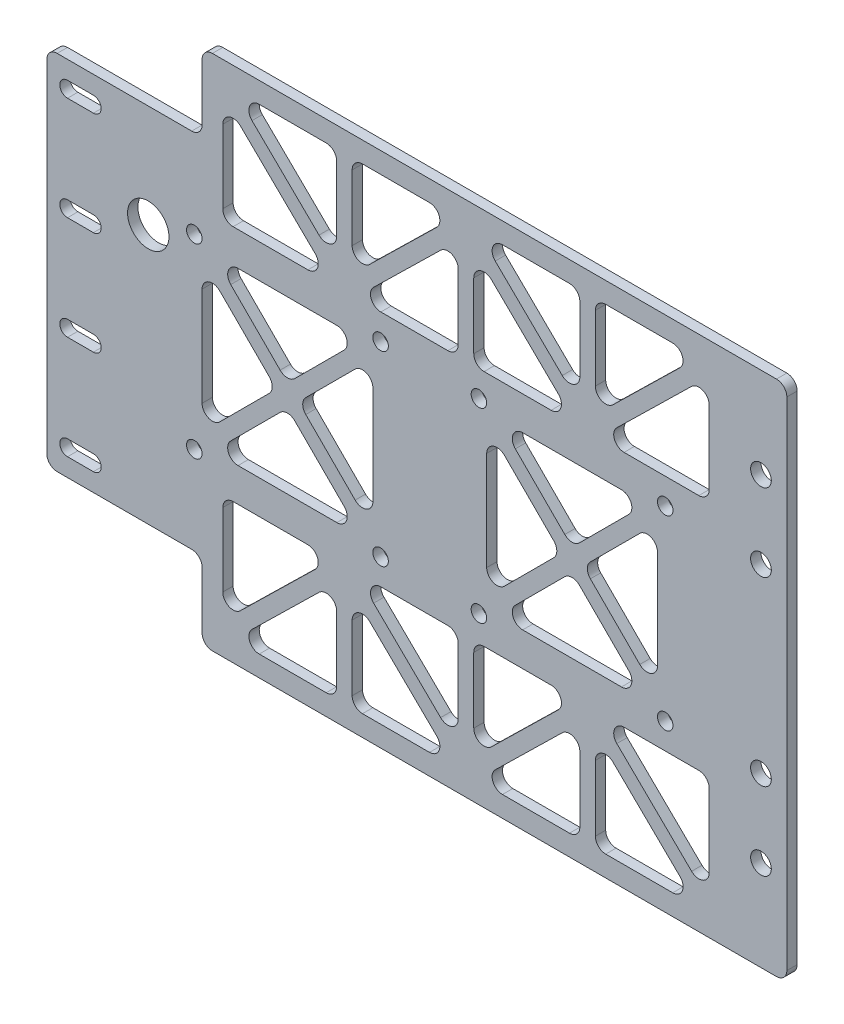
from build123d import *

# Parameters (mm, degrees)
SKETCH_1_W          = 143
SKETCH_1_H          = 100
EXTRUDE_1_DEPTH     = 2
SKETCH_2_R          = 2
CUT_EXTRUDE_1_DEPTH = 2
SKETCH_3_R          = 1.5
CUT_EXTRUDE_2_DEPTH = 2
SKETCH_4_W          = 30
SKETCH_4_H          = 15
CUT_EXTRUDE_3_DEPTH = 2
CUT_EXTRUDE_4_DEPTH = 2
SKETCH_6_R          = 4
CUT_EXTRUDE_5_DEPTH = 10
FILLET_1_R          = 2


with BuildPart() as part:
    # 草图1 → 凸台-拉伸1 (new body)
    with BuildSketch(Plane.XY):
        Rectangle(SKETCH_1_W, SKETCH_1_H)
    extrude(amount=EXTRUDE_1_DEPTH)

    # 草图2 → 切除-拉伸1 (cut)
    with BuildSketch(Plane.XY.offset(2)):
        with Locations((66.5, 32.5)):
            Circle(SKETCH_2_R)
        with Locations((66.5, 17.5)):
            Circle(SKETCH_2_R)
        with Locations(Location((66.5, -17.5, 0), (0, 0, 180))):
            Circle(SKETCH_2_R)
        with Locations(Location((66.5, -32.5, 0), (0, 0, 180))):
            Circle(SKETCH_2_R)
        with BuildLine():
            Line((-67.5, 11.5), (-62.5, 11.5))
            ThreePointArc((-62.5, 11.5), (-61, 10), (-62.5, 8.5))
            Line((-62.5, 8.5), (-67.5, 8.5))
            ThreePointArc((-67.5, 8.5), (-69, 10), (-67.5, 11.5))
        make_face()
        with BuildLine():
            Line((-67.5, 31.5), (-62.5, 31.5))
            ThreePointArc((-62.5, 31.5), (-61, 30), (-62.5, 28.5))
            Line((-62.5, 28.5), (-67.5, 28.5))
            ThreePointArc((-67.5, 28.5), (-69, 30), (-67.5, 31.5))
        make_face()
        with BuildLine():
            Line((-67.5, -31.5), (-62.5, -31.5))
            ThreePointArc((-62.5, -31.5), (-61, -30), (-62.5, -28.5))
            Line((-62.5, -28.5), (-67.5, -28.5))
            ThreePointArc((-67.5, -28.5), (-69, -30), (-67.5, -31.5))
        make_face()
        with BuildLine():
            Line((-67.5, -11.5), (-62.5, -11.5))
            ThreePointArc((-62.5, -11.5), (-61, -10), (-62.5, -8.5))
            Line((-62.5, -8.5), (-67.5, -8.5))
            ThreePointArc((-67.5, -8.5), (-69, -10), (-67.5, -11.5))
        make_face()
    extrude(amount=-CUT_EXTRUDE_1_DEPTH, mode=Mode.SUBTRACT)

    # 草图3 → 切除-拉伸2 (cut)
    with BuildSketch(Plane.XY.offset(2)):
        with Locations((48, 18)):
            Circle(SKETCH_3_R)
        with Locations((48, -18)):
            Circle(SKETCH_3_R)
        with Locations((12, -18)):
            Circle(SKETCH_3_R)
        with Locations((12, 18)):
            Circle(SKETCH_3_R)
        with Locations((-7, 18)):
            Circle(SKETCH_3_R)
        with Locations((-7, -18)):
            Circle(SKETCH_3_R)
        with Locations((-43, -18)):
            Circle(SKETCH_3_R)
        with Locations((-43, 18)):
            Circle(SKETCH_3_R)
    extrude(amount=-CUT_EXTRUDE_2_DEPTH, mode=Mode.SUBTRACT)

    # 草图4 → 切除-拉伸3 (cut)
    with BuildSketch(Plane.XY.offset(2)):
        with Locations((-56.5, 42.5)):
            Rectangle(SKETCH_4_W, SKETCH_4_H)
        with Locations((-56.5, -42.5)):
            Rectangle(SKETCH_4_W, SKETCH_4_H)
    extrude(amount=-CUT_EXTRUDE_3_DEPTH, mode=Mode.SUBTRACT)

    # 草图5 → 切除-拉伸4 (cut)
    with BuildSketch(Plane.XY.offset(2)):
        Polygon((-27.121320344, 0), (-41.5, -14.378679656), (-41.5, 14.378679656), align=None)
        Polygon((-25, 2.121320344), (-10.621320344, 16.5), (-39.378679656, 16.5), align=None)
        Polygon((-8.5, 14.378679656), (-8.5, -14.378679656), (-22.878679656, 0), align=None)
        Polygon((-39.378679656, -16.5), (-10.621320344, -16.5), (-25, -2.121320344), align=None)
        Polygon((13.5, 14.378679656), (13.5, -14.378679656), (27.878679656, 0), align=None)
        Polygon((44.378679656, 16.5), (30, 2.121320344), (15.621320344, 16.5), align=None)
        Polygon((32.121320344, 0), (46.5, -14.378679656), (46.5, 14.378679656), align=None)
        Polygon((30, -2.121320344), (44.378679656, -16.5), (15.621320344, -16.5), align=None)
        Polygon((56.5, -23), (35.144502137, -23), (56.5, -43.901125568), align=None)
        Polygon((54.355497863, -46), (34.5, -26.566959538), (34.5, -46), align=None)
        Polygon((31.5, -46), (31.5, -26.566959538), (11.644502137, -46), align=None)
        Polygon((11, -42.433040462), (30.855497863, -23), (11, -23), align=None)
        Polygon((8, -42.433040462), (8, -23), (-11.855497863, -23), align=None)
        Polygon((-12.5, -46), (7.355497863, -46), (-12.5, -26.566959538), align=None)
        Polygon((-35.355497863, -46), (-15.5, -46), (-15.5, -26.566959538), align=None)
        Polygon((-37.5, -43.901125568), (-16.144502137, -23), (-37.5, -23), align=None)
        Polygon((-16.144502137, 23), (-37.5, 43.901125568), (-37.5, 23), align=None)
        Polygon((-15.5, 46), (-35.355497863, 46), (-15.5, 26.566959538), align=None)
        Polygon((7.355497863, 46), (-12.5, 46), (-12.5, 26.566959538), align=None)
        Polygon((8, 42.433040462), (-11.855497863, 23), (8, 23), align=None)
        Polygon((30.855497863, 23), (11, 42.433040462), (11, 23), align=None)
        Polygon((31.5, 46), (11.644502137, 46), (31.5, 26.566959538), align=None)
        Polygon((54.355497863, 46), (34.5, 46), (34.5, 26.566959538), align=None)
        Polygon((56.5, 43.901125568), (35.144502137, 23), (56.5, 23), align=None)
    extrude(amount=-CUT_EXTRUDE_4_DEPTH, mode=Mode.SUBTRACT)

    # 草图6 → 切除-拉伸5 (cut)
    with BuildSketch(Plane.XY.offset(2)):
        with Locations((-51.9, 15.1)):
            Circle(SKETCH_6_R)
    extrude(amount=-CUT_EXTRUDE_5_DEPTH, mode=Mode.SUBTRACT)

    # 圆角1
    fillet_1_edges = [part.edges().sort_by_distance(p)[0] for p in [
        (-41.5, 35, 1),
        (-41.5, 50, 1),
        (-71.5, 35, 1),
        (-41.5, -50, 1),
        (-41.5, -35, 1),
        (-71.5, -35, 1),
        (-11.855497863, -23, 1),
        (8, -23, 1),
        (8, -42.433040462, 1),
        (11, -23, 1),
        (30.855497863, -23, 1),
        (11, -42.433040462, 1),
        (11.644502137, -46, 1),
        (31.5, -26.566959538, 1),
        (31.5, -46, 1),
        (34.5, -46, 1),
        (34.5, -26.566959538, 1),
        (54.355497863, -46, 1),
        (-37.5, 43.901125568, 1),
        (-16.144502137, 23, 1),
        (-37.5, 23, 1),
        (-37.5, -43.901125568, 1),
        (-37.5, -23, 1),
        (-16.144502137, -23, 1),
        (-35.355497863, -46, 1),
        (-15.5, -26.566959538, 1),
        (-15.5, -46, 1),
        (-12.5, -46, 1),
        (-12.5, -26.566959538, 1),
        (7.355497863, -46, 1),
        (13.5, -14.378679656, 1),
        (13.5, 14.378679656, 1),
        (27.878679656, 0, 1),
        (-10.621320344, -16.5, 1),
        (-39.378679656, -16.5, 1),
        (-25, -2.121320344, 1),
        (-10.621320344, 16.5, 1),
        (-25, 2.121320344, 1),
        (-39.378679656, 16.5, 1),
        (-8.5, 14.378679656, 1),
        (-8.5, -14.378679656, 1),
        (-22.878679656, 0, 1),
        (35.144502137, -23, 1),
        (56.5, -23, 1),
        (56.5, -43.901125568, 1),
        (30, -2.121320344, 1),
        (44.378679656, -16.5, 1),
        (15.621320344, -16.5, 1),
        (44.378679656, 16.5, 1),
        (30, 2.121320344, 1),
        (15.621320344, 16.5, 1),
        (46.5, -14.378679656, 1),
        (32.121320344, 0, 1),
        (46.5, 14.378679656, 1),
        (31.5, 26.566959538, 1),
        (11.644502137, 46, 1),
        (31.5, 46, 1),
        (34.5, 26.566959538, 1),
        (34.5, 46, 1),
        (54.355497863, 46, 1),
        (35.144502137, 23, 1),
        (56.5, 43.901125568, 1),
        (56.5, 23, 1),
        (-15.5, 26.566959538, 1),
        (-35.355497863, 46, 1),
        (-15.5, 46, 1),
        (-12.5, 26.566959538, 1),
        (-12.5, 46, 1),
        (7.355497863, 46, 1),
        (8, 42.433040462, 1),
        (8, 23, 1),
        (-11.855497863, 23, 1),
        (11, 42.433040462, 1),
        (30.855497863, 23, 1),
        (11, 23, 1),
        (-27.121320344, 0, 1),
        (-41.5, -14.378679656, 1),
        (-41.5, 14.378679656, 1),
        (71.5, -50, 1),
        (71.5, 50, 1),
    ]]
    fillet(fillet_1_edges, radius=FILLET_1_R)


solid = part.part
